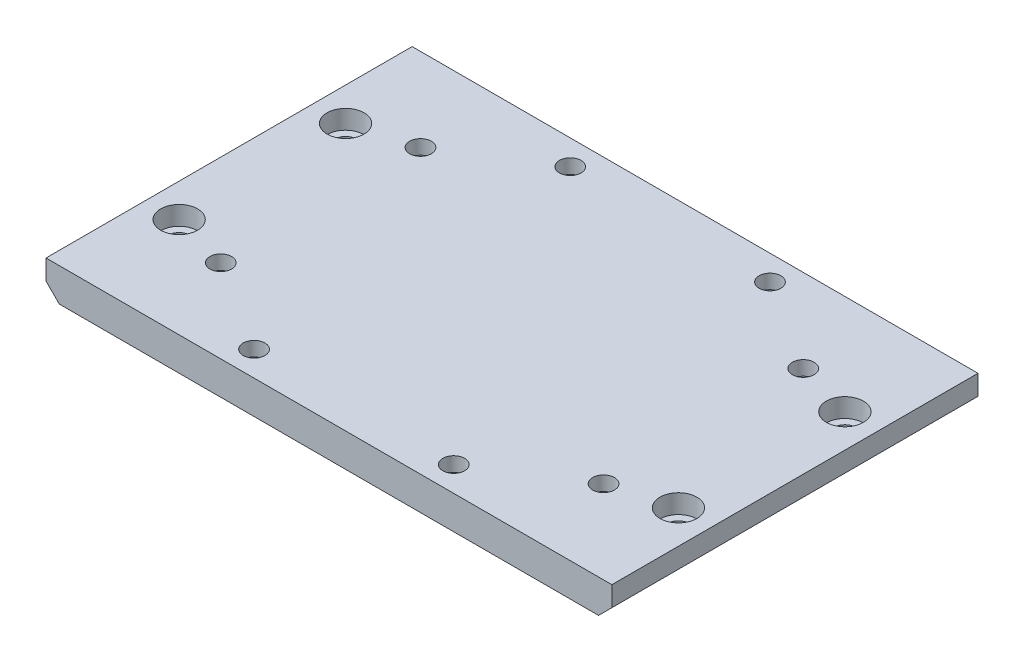
from build123d import *

# Parameters (mm, degrees)
SKETCH2_W                                      = 55
SKETCH2_H                                      = 55
BOSS_EXTRUDE1_DEPTH                            = 5
SKETCH6_W                                      = 15
SKETCH6_H                                      = 55
BOSS_EXTRUDE2_DEPTH                            = 5
CBORE_FOR_4_SOCKET_HEAD_CAP_SCREW2_D           = 3.2639
CBORE_FOR_4_SOCKET_HEAD_CAP_SCREW2_CBORE_D     = 5.55752
CBORE_FOR_4_SOCKET_HEAD_CAP_SCREW2_CBORE_DEPTH = 2.8448
CBORE_FOR_4_SOCKET_HEAD_CAP_SCREW3_D           = 3.2639
CBORE_FOR_4_SOCKET_HEAD_CAP_SCREW3_CBORE_D     = 5.55752
CBORE_FOR_4_SOCKET_HEAD_CAP_SCREW3_CBORE_DEPTH = 2.8448
CHAMFER1_SIZE                                  = 2


with BuildPart() as part:
    # Sketch2 → Boss-Extrude1 (new body)
    with BuildSketch(Plane(origin=(0, 0, 0), x_dir=(1, 0, 0), z_dir=(0, 1, 0))):
        Rectangle(SKETCH2_W, SKETCH2_H)
    extrude(amount=BOSS_EXTRUDE1_DEPTH)

    # Sketch6 → Boss-Extrude2 (add)
    with BuildSketch(Plane.XZ):
        with Locations((-35, 0)):
            Rectangle(SKETCH6_W, SKETCH6_H)
        with Locations((35, 0)):
            Rectangle(SKETCH6_W, SKETCH6_H)
    extrude(amount=-BOSS_EXTRUDE2_DEPTH)

    # CBORE for #4 Socket Head Cap Screw2 (through all)
    with Locations(Plane(origin=(0, 5, 0), x_dir=(1, 0, 0), z_dir=(0, 1, 0))):
        with Locations((-37.5, 12.5), (-37.5, -12.5), (37.5, -12.5), (37.5, 12.5)):
            CounterBoreHole(CBORE_FOR_4_SOCKET_HEAD_CAP_SCREW2_D / 2, CBORE_FOR_4_SOCKET_HEAD_CAP_SCREW2_CBORE_D / 2, CBORE_FOR_4_SOCKET_HEAD_CAP_SCREW2_CBORE_DEPTH)

    # CBORE for #4 Socket Head Cap Screw3 (through all)
    with Locations(Plane(origin=(0, 0, 0), x_dir=(-1, 0, 0), z_dir=(0, -1, 0))):
        with Locations((-28.75, 15), (-15, 23.75), (-28.75, -15), (-15, -23.75), (15, -23.75), (28.75, -15), (28.75, 15), (15, 23.75)):
            CounterBoreHole(CBORE_FOR_4_SOCKET_HEAD_CAP_SCREW3_D / 2, CBORE_FOR_4_SOCKET_HEAD_CAP_SCREW3_CBORE_D / 2, CBORE_FOR_4_SOCKET_HEAD_CAP_SCREW3_CBORE_DEPTH)

    # Chamfer1
    chamfer1_edges = [part.edges().sort_by_distance(p)[0] for p in [
        (-42.5, 0, 0),
        (42.5, 0, 0),
    ]]
    chamfer(chamfer1_edges, length=CHAMFER1_SIZE)


solid = part.part
